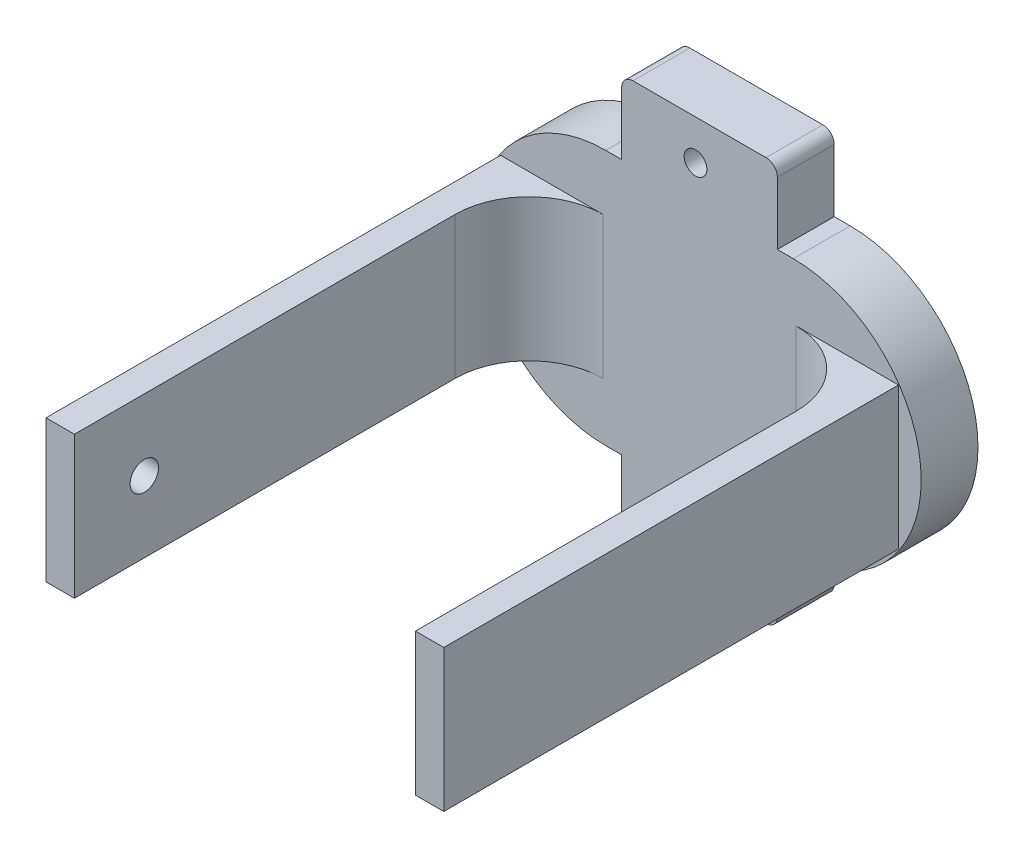
from build123d import *

# Parameters (mm, degrees)
SKETCH_1_R          = 2
EXTRUDE_1_DEPTH     = 10
SKETCH_2_W          = 5
SKETCH_2_H          = 25
EXTRUDE_2_DEPTH     = 80
EXTRUDE_3_DEPTH     = 25
EXTRUDE_4_DEPTH     = 25
CUT_EXTRUDE_1_REACH = 124.376
SKETCH_8_R          = 2.5


with BuildPart() as part:
    # 草圖1 → 填料-伸長1 (new body)
    # profile 1 of 3: a face of its own
    with BuildSketch(Plane.XY):
        with BuildLine():
            Line((-12.867229619, 32.988964319), (20.132770381, 32.988964319))
            ThreePointArc((20.132770381, 32.988964319), (42.632770381, 10.488964319), (20.132770381, -12.011035681))
            Line((20.132770381, -12.011035681), (-12.867229619, -12.011035681))
            ThreePointArc((-12.867229619, -12.011035681), (-35.367229619, 10.488964319), (-12.867229619, 32.988964319))
        make_face()
    # profile 2 of 3: a face of its own
    with BuildSketch(Plane.XY):
        with BuildLine():
            Line((-10.067229619, 32.988964319), (17.332770381, 32.988964319))
            Line((17.332770381, 32.988964319), (17.332770381, 43.988964319))
            ThreePointArc((17.332770381, 43.988964319), (16.746983944, 45.403177881), (15.332770381, 45.988964319))
            Line((15.332770381, 45.988964319), (-8.067229619, 45.988964319))
            ThreePointArc((-8.067229619, 45.988964319), (-9.481443181, 45.403177881), (-10.067229619, 43.988964319))
            Line((-10.067229619, 43.988964319), (-10.067229619, 32.988964319))
        make_face()
        with Locations((2.921464597, 38.988964319)):
            Circle(SKETCH_1_R, mode=Mode.SUBTRACT)
    # profile 3 of 3: a face of its own
    with BuildSketch(Plane.XY):
        with BuildLine():
            Line((-10.067229619, -12.011035681), (17.332770381, -12.011035681))
            Line((17.332770381, -12.011035681), (17.332770381, -23.011035681))
            ThreePointArc((17.332770381, -23.011035681), (16.746983944, -24.425249243), (15.332770381, -25.011035681))
            Line((15.332770381, -25.011035681), (-8.067229619, -25.011035681))
            ThreePointArc((-8.067229619, -25.011035681), (-9.481443181, -24.425249243), (-10.067229619, -23.011035681))
            Line((-10.067229619, -23.011035681), (-10.067229619, -12.011035681))
        make_face()
        with Locations((2.921464597, -18.011035681)):
            Circle(SKETCH_1_R, mode=Mode.SUBTRACT)
    extrude(amount=EXTRUDE_1_DEPTH)

    # 草圖2 → 填料-伸長2 (add)
    with BuildSketch(Plane.XY.offset(10)):
        with Locations((-28.867229619, 10.488964319)):
            Rectangle(SKETCH_2_W, SKETCH_2_H)
        with Locations((36.132770381, 10.488964319)):
            Rectangle(SKETCH_2_W, SKETCH_2_H)
    extrude(amount=EXTRUDE_2_DEPTH)

    # 草圖6 → 填料-伸長3 (add)
    with BuildSketch(Plane.XZ.offset(2.011035681)):
        with BuildLine():
            ThreePointArc((-13.367229619, 10), (-22.559617774, 13.807611845), (-26.367229619, 23))
            Line((-26.367229619, 23), (-26.367229619, 10))
            Line((-26.367229619, 10), (-13.367229619, 10))
        make_face()
    extrude(amount=-EXTRUDE_3_DEPTH)

    # 草圖7 → 填料-伸長4 (add)
    with BuildSketch(Plane.XZ.offset(2.011035681)):
        with BuildLine():
            ThreePointArc((33.632770381, 23), (29.825158537, 13.807611845), (20.632770381, 10))
            Line((20.632770381, 10), (33.632770381, 10))
            Line((33.632770381, 10), (33.632770381, 23))
        make_face()
    extrude(amount=-EXTRUDE_4_DEPTH)

    # 草圖8 → 除料-伸長1 (cut, up to next)
    with BuildSketch(Plane(origin=(-26.367229619, 0, 0), x_dir=(0, 0, -1), z_dir=(1, 0, 0)), mode=Mode.PRIVATE) as cut_extrude_1_sk1:
        with Locations(Location((-77.7, 10.488964319, 0), (0, 0, 90))):
            Circle(SKETCH_8_R)
    cut_extrude_1_tool1 = extrude(cut_extrude_1_sk1.sketch, amount=-CUT_EXTRUDE_1_REACH, mode=Mode.PRIVATE) & part.part
    add(cut_extrude_1_tool1.solids().sort_by_distance((-26.36723, 10.488964, 77.7))[0], mode=Mode.SUBTRACT)


solid = part.part
